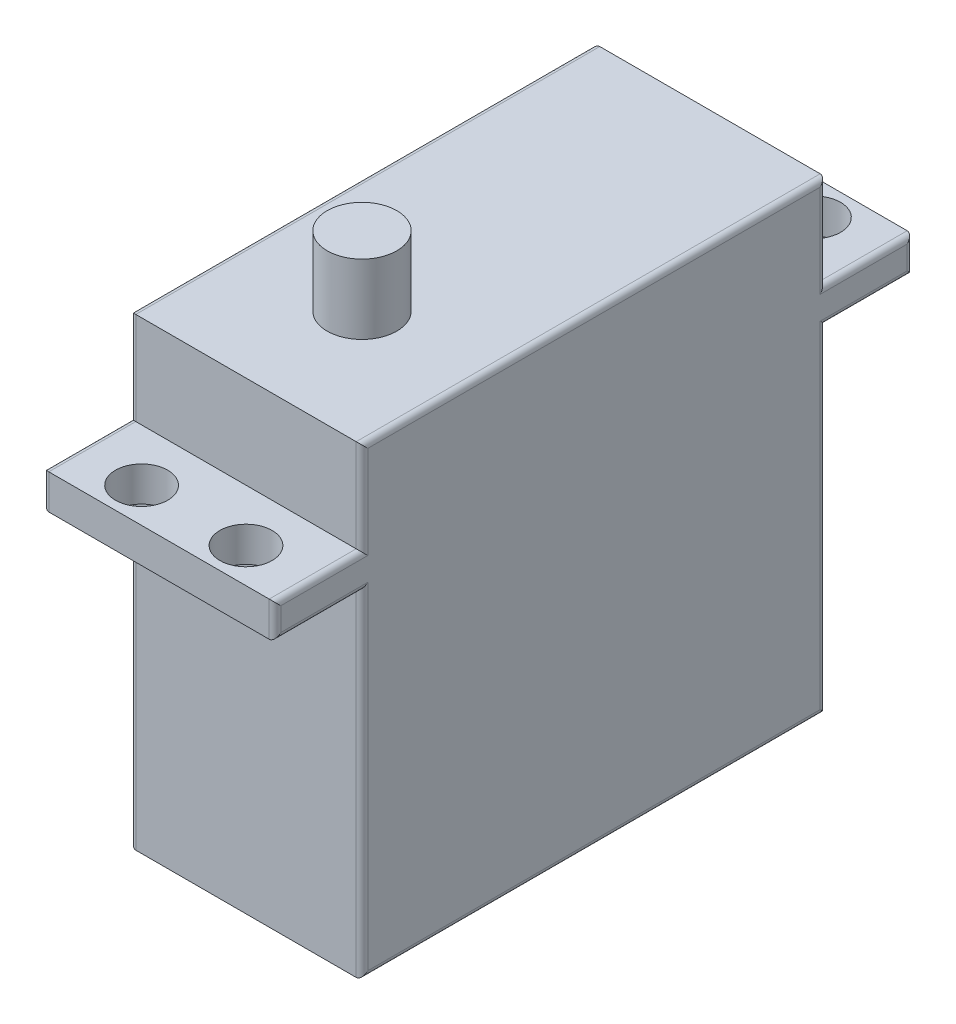
from build123d import *

# Parameters (mm, degrees)
SKETCH_1_W          = 40
SKETCH_1_H          = 40
EXTRUDE_1_DEPTH     = 20
SKETCH_2_R          = 3
EXTRUDE_2_DEPTH     = 6
EXTRUDE_START       = -8
SKETCH_3_W          = 20
SKETCH_3_H          = 7.5
EXTRUDE_3_DEPTH     = 3
SKETCH_4_R          = 2.25
CUT_EXTRUDE_1_DEPTH = 3
FILLET_1_R          = 0.5


with BuildPart() as part:
    # 草图1 → 凸台-拉伸1 (new body)
    with BuildSketch(Plane(origin=(0, 0, 0), x_dir=(0, 0, -1), z_dir=(1, 0, 0))):
        Rectangle(SKETCH_1_W, SKETCH_1_H)
    extrude(amount=EXTRUDE_1_DEPTH)

    # 草图2 → 凸台-拉伸2 (add)
    with BuildSketch(Plane(origin=(0, 20, 0), x_dir=(1, 0, 0), z_dir=(0, 1, 0))):
        with Locations(Location((10, -10, 0), (0, 0, 90))):
            Circle(SKETCH_2_R)
    extrude(amount=EXTRUDE_2_DEPTH)

    # 草图3 → 凸台-拉伸3 (add)
    with BuildSketch(Plane(origin=(0, 20, 0), x_dir=(1, 0, 0), z_dir=(0, 1, 0)).offset(EXTRUDE_START)):
        with Locations((10, -23.75)):
            Rectangle(SKETCH_3_W, SKETCH_3_H)
        with Locations((10, 23.75)):
            Rectangle(SKETCH_3_W, SKETCH_3_H)
    extrude(amount=-EXTRUDE_3_DEPTH)

    # 草图4 → 切除-拉伸1 (cut)
    with BuildSketch(Plane(origin=(0, 12, 0), x_dir=(1, 0, 0), z_dir=(0, 1, 0))):
        with Locations(Location((14.5, -24.5, 0), (0, 0, 270))):
            Circle(SKETCH_4_R)
        with Locations(Location((5.5, -24.5, 0), (0, 0, 270))):
            Circle(SKETCH_4_R)
        with Locations(Location((5.5, 24.5, 0), (0, 0, 90))):
            Circle(SKETCH_4_R)
        with Locations(Location((14.5, 24.5, 0), (0, 0, 90))):
            Circle(SKETCH_4_R)
    extrude(amount=-CUT_EXTRUDE_1_DEPTH, mode=Mode.SUBTRACT)

    # 圆角1
    fillet_1_edges = [part.edges().sort_by_distance(p)[0] for p in [
        (20, -5.5, -20),
        (20, 20, 0),
        (0, 16, -20),
        (20, 16, -20),
        (0, -5.5, 20),
        (20, -5.5, 20),
        (0, 9, 23.75),
        (0, 10.5, 27.5),
        (20, 9, 23.75),
        (20, 10.5, 27.5),
        (0, 12, 23.75),
        (20, 12, 23.75),
        (0, 9, -23.75),
        (0, 10.5, -27.5),
        (20, 9, -23.75),
        (20, 10.5, -27.5),
        (0, 12, -23.75),
        (20, 12, -23.75),
        (20, 16, 20),
        (0, 20, 0),
        (0, -5.5, -20),
        (0, -20, 0),
        (0, 16, 20),
        (20, -20, 0),
    ]]
    fillet(fillet_1_edges, radius=FILLET_1_R)


solid = part.part
